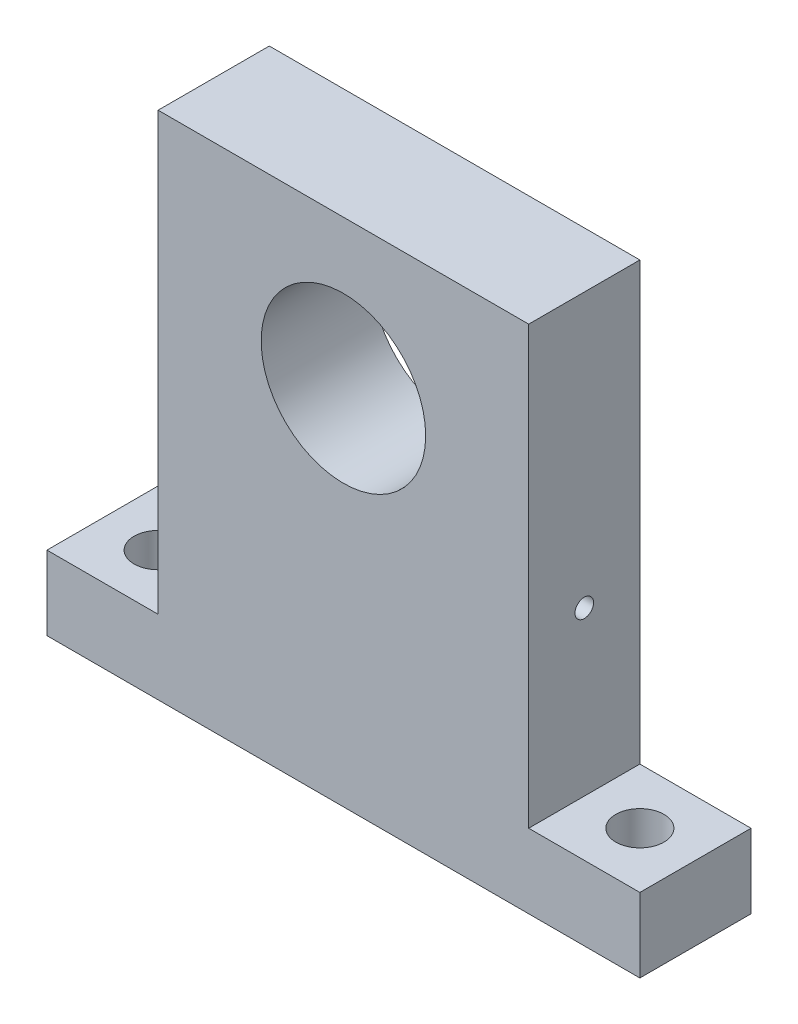
from build123d import *

# Parameters (mm, degrees)
SKETCH1_R           = 11.0998
BOSS_EXTRUDE1_DEPTH = 15
SKETCH2_R           = 3.25
CUT_EXTRUDE1_DEPTH  = 73.765855395
SKETCH3_R           = 1.25
CUT_EXTRUDE2_DEPTH  = 4.5


with BuildPart() as part:
    # Sketch1 → Boss-Extrude1 (new body)
    with BuildSketch(Plane.XY):
        Polygon((-40, 0), (40, 0), (40, 10), (25, 10), (25, 68.9056), (-25, 68.9056), (-25, 10), (-40, 10), align=None)
        with Locations((0, 48.9056)):
            Circle(SKETCH1_R, mode=Mode.SUBTRACT)
    extrude(amount=BOSS_EXTRUDE1_DEPTH)

    # Sketch2 → Cut-Extrude1 (cut, through all)
    with BuildSketch(Plane(origin=(0, 10, 0), x_dir=(1, 0, 0), z_dir=(0, 1, 0))):
        with Locations(Location((-32.5, -7.5, 0), (0, 0, 180))):
            Circle(SKETCH2_R)
        with Locations(Location((32.5, -7.5, 0), (0, 0, 180))):
            Circle(SKETCH2_R)
    extrude(amount=-CUT_EXTRUDE1_DEPTH, mode=Mode.SUBTRACT)

    # Sketch3 → Cut-Extrude2 (cut)
    with BuildSketch(Plane(origin=(25, 0, 0), x_dir=(0, 0, -1), z_dir=(1, 0, 0))):
        with Locations(Location((-7.5, 32, 0), (0, 0, 90))):
            Circle(SKETCH3_R)
    extrude(amount=-CUT_EXTRUDE2_DEPTH, mode=Mode.SUBTRACT)


solid = part.part
